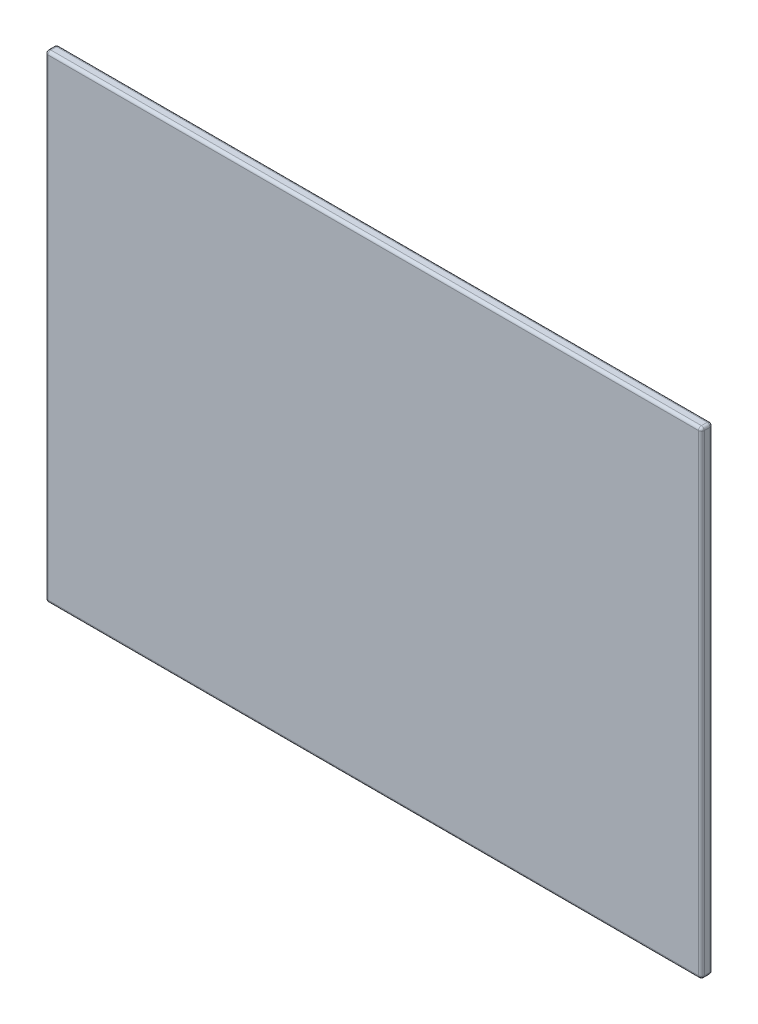
from build123d import *

# Parameters (mm, degrees)
SKETCH1_W           = 114.7
SKETCH1_H           = 83.5
BOSS_EXTRUDE1_DEPTH = 2
FILLET1_R           = 0.5


with BuildPart() as part:
    # Sketch1 → Boss-Extrude1 (new body)
    with BuildSketch(Plane.XY):
        Rectangle(SKETCH1_W, SKETCH1_H)
    extrude(amount=BOSS_EXTRUDE1_DEPTH)

    # Fillet1
    fillet1_edges = [part.edges().sort_by_distance(p)[0] for p in [
        (-57.35, 0, 2),
        (0, -41.75, 2),
        (57.35, 0, 2),
        (0, -41.75, 0),
        (-57.35, 0, 0),
        (0, 41.75, 0),
        (57.35, 0, 0),
        (57.35, -41.75, 1),
        (-57.35, -41.75, 1),
        (-57.35, 41.75, 1),
        (57.35, 41.75, 1),
        (0, 41.75, 2),
    ]]
    fillet(fillet1_edges, radius=FILLET1_R)


solid = part.part
